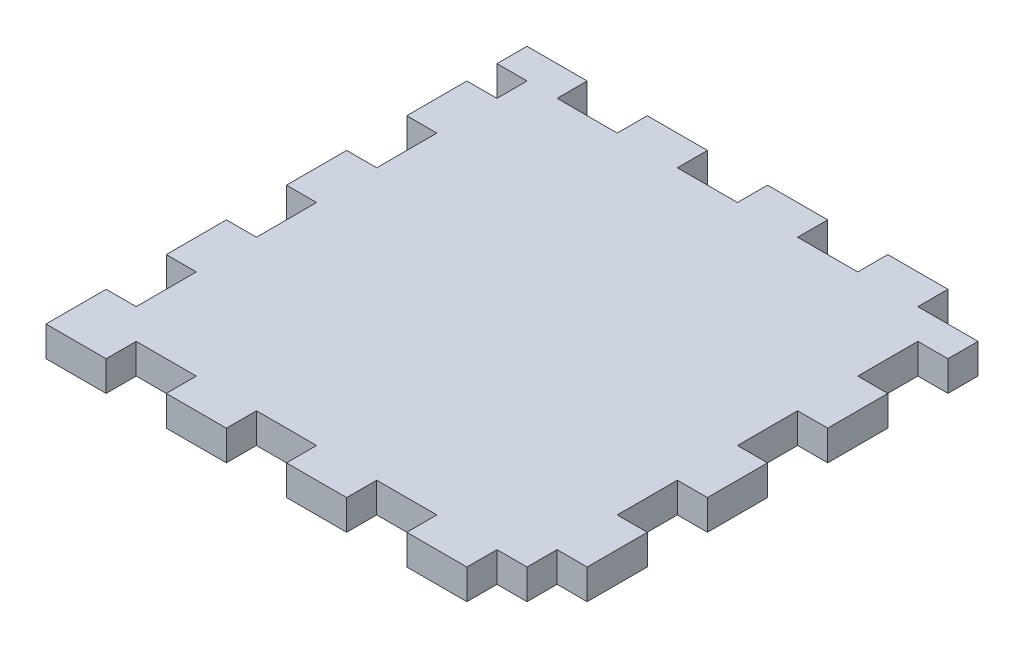
from build123d import *

# Parameters (mm, degrees)
SKETCH1_W           = 101.6
SKETCH1_H           = 101.6
BOSS_EXTRUDE1_DEPTH = 6.35
SKETCH2_W           = 6.35
SKETCH2_H           = 6.35
SKETCH2_H_2         = 12.7
SKETCH2_W_2         = 12.7
CUT_EXTRUDE1_DEPTH  = 6.35


with BuildPart() as part:
    # Sketch1 → Boss-Extrude1 (new body)
    with BuildSketch(Plane(origin=(0, 0, 0), x_dir=(1, 0, 0), z_dir=(0, 1, 0))):
        with Locations((50.8, 50.8)):
            Rectangle(SKETCH1_W, SKETCH1_H)
    extrude(amount=BOSS_EXTRUDE1_DEPTH)

    # Sketch2 → Cut-Extrude1 (cut)
    with BuildSketch(Plane(origin=(0, 6.35, 0), x_dir=(1, 0, 0), z_dir=(0, 1, 0))):
        with Locations((3.175, 92.075)):
            Rectangle(SKETCH2_W, SKETCH2_H)
        with Locations((3.175, 69.85)):
            Rectangle(SKETCH2_W, SKETCH2_H_2)
        with Locations((3.175, 44.45)):
            Rectangle(SKETCH2_W, SKETCH2_H_2)
        with Locations((3.175, 19.05)):
            Rectangle(SKETCH2_W, SKETCH2_H_2)
        with Locations((19.05, 98.425)):
            Rectangle(SKETCH2_W_2, SKETCH2_H)
        with Locations((44.45, 98.425)):
            Rectangle(SKETCH2_W_2, SKETCH2_H)
        with Locations((69.85, 98.425)):
            Rectangle(SKETCH2_W_2, SKETCH2_H)
        with Locations((92.075, 98.425)):
            Rectangle(SKETCH2_W, SKETCH2_H)
        with Locations((98.425, 98.425)):
            Rectangle(SKETCH2_W, SKETCH2_H)
        with Locations((98.425, 82.55)):
            Rectangle(SKETCH2_W, SKETCH2_H_2)
        with Locations((98.425, 57.15)):
            Rectangle(SKETCH2_W, SKETCH2_H_2)
        with Locations((98.425, 31.75)):
            Rectangle(SKETCH2_W, SKETCH2_H_2)
        with Locations((98.425, 9.525)):
            Rectangle(SKETCH2_W, SKETCH2_H)
        with Locations((98.425, 3.175)):
            Rectangle(SKETCH2_W, SKETCH2_H)
        with Locations((92.075, 3.175)):
            Rectangle(SKETCH2_W, SKETCH2_H)
        with Locations((69.85, 3.175)):
            Rectangle(SKETCH2_W_2, SKETCH2_H)
        with Locations((44.45, 3.175)):
            Rectangle(SKETCH2_W_2, SKETCH2_H)
        with Locations((19.05, 3.175)):
            Rectangle(SKETCH2_W_2, SKETCH2_H)
    extrude(amount=-CUT_EXTRUDE1_DEPTH, mode=Mode.SUBTRACT)


solid = part.part
